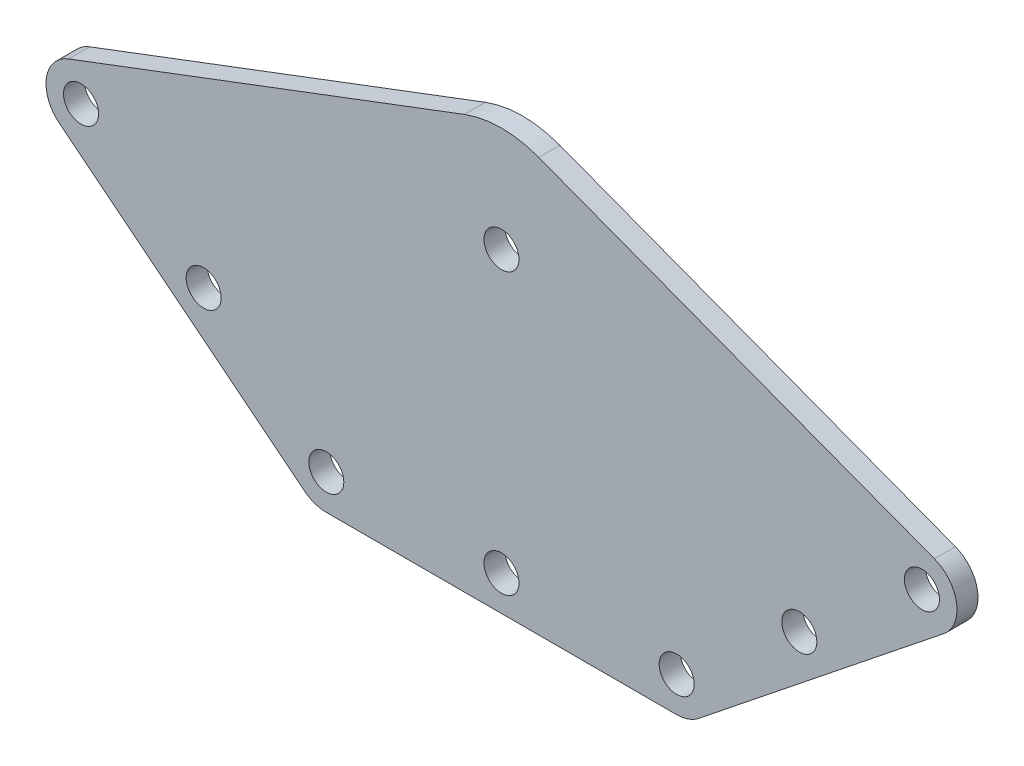
from build123d import *

# Parameters (mm, degrees)
SKETCH2_R           = 2.5
BOSS_EXTRUDE1_DEPTH = 3


with BuildPart() as part:
    # Sketch2 → Boss-Extrude1 (new body)
    with BuildSketch(Plane.XY):
        with BuildLine():
            Line((-61.770239404, 32.654595977), (-5.310718211, 54.028409464))
            ThreePointArc((-5.310718211, 54.028409464), (0, 55), (5.310718211, 54.028409464))
            Line((5.310718211, 54.028409464), (61.770239404, 32.654595977))
            ThreePointArc((61.770239404, 32.654595977), (64.939100687, 28.75645975), (63.122009394, 24.072943218))
            Line((63.122009394, 24.072943218), (28.122009394, -3.905516271))
            ThreePointArc((28.122009394, -3.905516271), (26.654149123, -4.718452149), (25, -5))
            Line((25, -5), (0, -5))
            Line((0, -5), (-25, -5))
            ThreePointArc((-25, -5), (-26.654149123, -4.718452149), (-28.122009394, -3.905516271))
            Line((-28.122009394, -3.905516271), (-63.122009394, 24.072943218))
            ThreePointArc((-63.122009394, 24.072943218), (-64.939100687, 28.75645975), (-61.770239404, 32.654595977))
        make_face()
        with Locations((-60, 27.978459489)):
            Circle(SKETCH2_R, mode=Mode.SUBTRACT)
        with Locations((0, 40)):
            Circle(SKETCH2_R, mode=Mode.SUBTRACT)
        with Locations((60, 27.978459489)):
            Circle(SKETCH2_R, mode=Mode.SUBTRACT)
        with Locations((25, 0)):
            Circle(SKETCH2_R, mode=Mode.SUBTRACT)
        Circle(SKETCH2_R, mode=Mode.SUBTRACT)
        with Locations((-25, 0)):
            Circle(SKETCH2_R, mode=Mode.SUBTRACT)
        with Locations((-42.5, 13.989229745)):
            Circle(SKETCH2_R, mode=Mode.SUBTRACT)
        with Locations((42.5, 13.989229745)):
            Circle(SKETCH2_R, mode=Mode.SUBTRACT)
    extrude(amount=BOSS_EXTRUDE1_DEPTH)


solid = part.part
